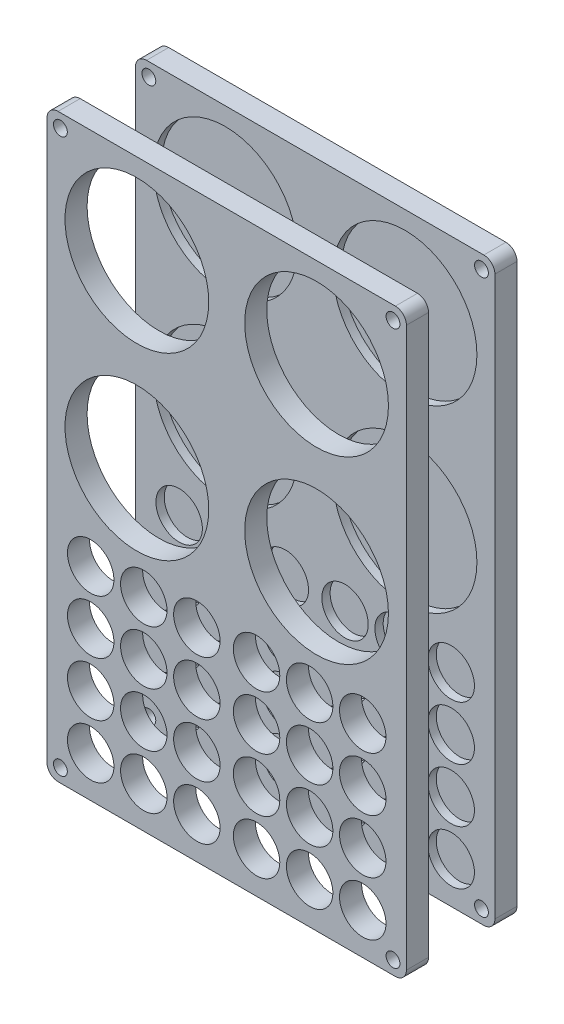
from build123d import *

# Parameters (mm, degrees)
SKETCH1_W                          = 210
SKETCH1_H                          = 130
F_120_X_200_X_67_TH_DEPTH          = 40
SKETCH2_R                          = 26
SKETCH2_R_2                        = 8.4
F_16_8_D_AND_52_D_TUBE_HOLES_DEPTH = 35
F_4_MM_R_FILET_R                   = 4
CUT_EXTRUDE1_DEPTH                 = 130.807549857
CUT_EXTRUDE1_DEPTH_BACK            = 130.807549857
SKETCH3_W                          = 210
SKETCH3_H                          = 24
CUT_EXTRUDE2_DEPTH                 = 130.807549857
CUT_EXTRUDE2_DEPTH_BACK            = 130.807549857
SKETCH2_3_R                        = 2.5


with BuildPart() as part:
    # Sketch1 → 120 x 200 x 67 th (new body)
    with BuildSketch(Plane(origin=(0, 0, 0), x_dir=(0, 1, 0), z_dir=(0, 0, 1))):
        Rectangle(SKETCH1_W, SKETCH1_H)
    extrude(amount=F_120_X_200_X_67_TH_DEPTH)

    # Sketch2 → 16.8 D and 52 D tube holes (cut)
    with BuildSketch(Plane.XY.offset(40)):
        with Locations((-32.5, 72.5)):
            Circle(SKETCH2_R)
        with Locations((10.8, -31.641617153)):
            Circle(SKETCH2_R_2)
        with Locations((30, -31.641617153)):
            Circle(SKETCH2_R_2)
        with Locations((49.2, -31.641617153)):
            Circle(SKETCH2_R_2)
        with Locations((-10.8, -31.641617153)):
            Circle(SKETCH2_R_2)
        with Locations((-30, -31.641617153)):
            Circle(SKETCH2_R_2)
        with Locations((-49.2, -31.641617153)):
            Circle(SKETCH2_R_2)
        with Locations((10.8, -51.141617153)):
            Circle(SKETCH2_R_2)
        with Locations((30, -51.141617153)):
            Circle(SKETCH2_R_2)
        with Locations((49.2, -51.141617153)):
            Circle(SKETCH2_R_2)
        with Locations((-10.8, -51.141617153)):
            Circle(SKETCH2_R_2)
        with Locations((-30, -51.141617153)):
            Circle(SKETCH2_R_2)
        with Locations((-49.2, -51.141617153)):
            Circle(SKETCH2_R_2)
        with Locations((10.8, -70.641617153)):
            Circle(SKETCH2_R_2)
        with Locations((30, -70.641617153)):
            Circle(SKETCH2_R_2)
        with Locations((49.2, -70.641617153)):
            Circle(SKETCH2_R_2)
        with Locations((-10.8, -70.641617153)):
            Circle(SKETCH2_R_2)
        with Locations((-30, -70.641617153)):
            Circle(SKETCH2_R_2)
        with Locations((-49.2, -70.641617153)):
            Circle(SKETCH2_R_2)
        with Locations((10.8, -90.141617153)):
            Circle(SKETCH2_R_2)
        with Locations((30, -90.141617153)):
            Circle(SKETCH2_R_2)
        with Locations((49.2, -90.141617153)):
            Circle(SKETCH2_R_2)
        with Locations((-10.8, -90.141617153)):
            Circle(SKETCH2_R_2)
        with Locations((-30, -90.141617153)):
            Circle(SKETCH2_R_2)
        with Locations((-49.2, -90.141617153)):
            Circle(SKETCH2_R_2)
        with Locations((32.5, 72.5)):
            Circle(SKETCH2_R)
        with Locations((32.5, 7.5)):
            Circle(SKETCH2_R)
        with Locations((-32.5, 7.5)):
            Circle(SKETCH2_R)
    extrude(amount=-F_16_8_D_AND_52_D_TUBE_HOLES_DEPTH, mode=Mode.SUBTRACT)

    # 4 mm R filet
    f_4_mm_r_filet_edges = [part.edges().sort_by_distance(p)[0] for p in [
        (-65, 105, 20),
        (65, 105, 20),
        (-65, -105, 20),
        (65, -105, 20),
    ]]
    fillet(f_4_mm_r_filet_edges, radius=F_4_MM_R_FILET_R)

    # Sketch3 → Cut-Extrude1 (cut, two sides: drawn at the far end of the back side and taken through both)
    with BuildSketch(Plane.YZ.offset(-CUT_EXTRUDE1_DEPTH_BACK)):
        with Locations((0, 20)):
            Rectangle(SKETCH3_W, SKETCH3_H)
    extrude(amount=CUT_EXTRUDE1_DEPTH + CUT_EXTRUDE1_DEPTH_BACK, mode=Mode.SUBTRACT)


with BuildPart() as cut_extrude1_piece_1:
    # of the separate pieces the step leaves, piece 1, a body of its own (cut_extrude1_pieces)
    add(part.part.solids().sort_by_distance((65, -101, 0))[0])


with BuildPart() as cut_extrude1_piece_2:
    # of the separate pieces the step leaves, piece 2, a body of its own (cut_extrude1_pieces)
    add(part.part.solids().sort_by_distance((65, 101, 32))[0])


with BuildPart() as cut_extrude2_tool:
    # Sketch2<3> → Cut-Extrude2 (new, two sides: drawn at the far end of the back side and taken through both)
    with BuildSketch(Plane.XY.offset(40).offset(-CUT_EXTRUDE2_DEPTH_BACK)):
        with Locations((-60.158155916, -100.158155916)):
            Circle(SKETCH2_3_R)
        with Locations((-60.158155916, 100.158155916)):
            Circle(SKETCH2_3_R)
        with Locations((60.158155916, -100.158155916)):
            Circle(SKETCH2_3_R)
        with Locations((60.158155916, 100.158155916)):
            Circle(SKETCH2_3_R)
    extrude(amount=CUT_EXTRUDE2_DEPTH + CUT_EXTRUDE2_DEPTH_BACK)


with BuildPart() as cut_extrude1_piece_1_1:
    add(cut_extrude1_piece_1.part)

    # Cut-Extrude2: cut by cut_extrude2_tool
    add(cut_extrude2_tool.part, mode=Mode.SUBTRACT)


with BuildPart() as cut_extrude1_piece_2_1:
    add(cut_extrude1_piece_2.part)

    # Cut-Extrude2: cut by cut_extrude2_tool
    add(cut_extrude2_tool.part, mode=Mode.SUBTRACT)


solid = Compound([cut_extrude1_piece_1_1.part, cut_extrude1_piece_2_1.part])
